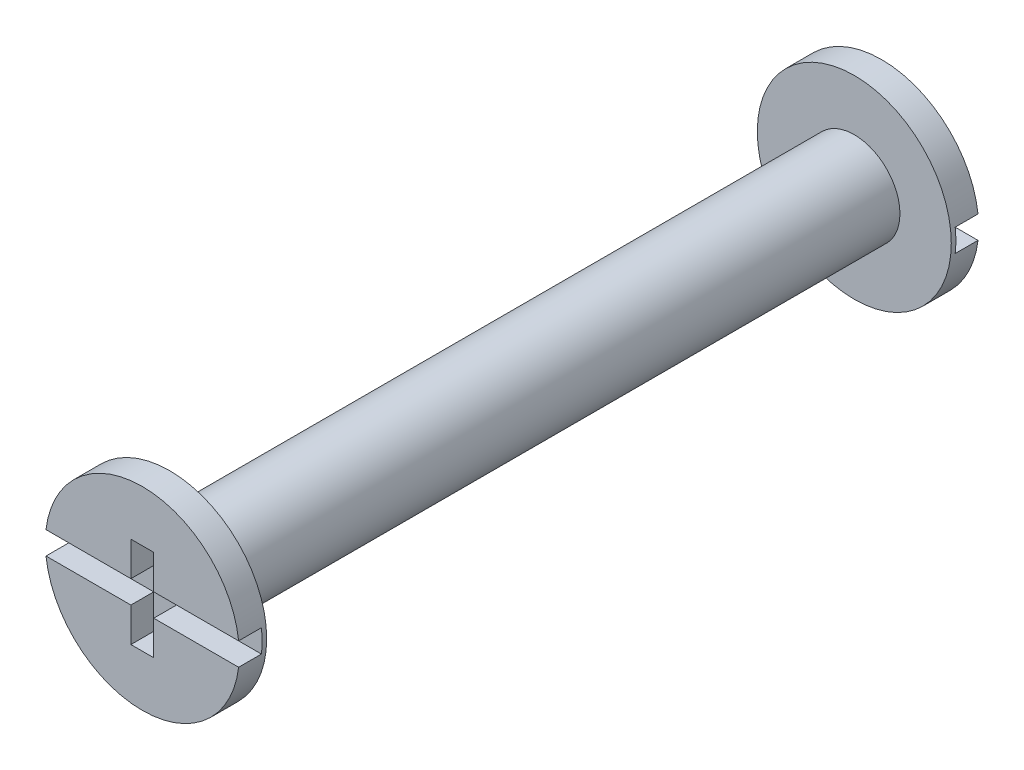
from build123d import *

# Parameters (mm, degrees)
SKETCH_1_R          = 4.25
EXTRUDE_1_DEPTH     = 1.2
SKETCH_2_R          = 2
EXTRUDE_2_DEPTH     = 30
SKETCH_3_R          = 4.25
EXTRUDE_3_DEPTH     = 1.2
CUT_EXTRUDE_1_DEPTH = 1
CUT_EXTRUDE_2_DEPTH = 1


with BuildPart() as part:
    # 草图1 → 凸台-拉伸1 (new body)
    with BuildSketch(Plane.XY):
        Circle(SKETCH_1_R)
    extrude(amount=EXTRUDE_1_DEPTH)

    # 草图2 → 凸台-拉伸2 (add)
    with BuildSketch(Plane.XY.offset(1.2)):
        Circle(SKETCH_2_R)
    extrude(amount=EXTRUDE_2_DEPTH)

    # 草图3 → 凸台-拉伸3 (add)
    with BuildSketch(Plane.XY.offset(31.2)):
        Circle(SKETCH_3_R)
    extrude(amount=EXTRUDE_3_DEPTH)

    # 草图4 → 切除-拉伸1 (cut)
    with BuildSketch(Plane.XY.offset(32.4)):
        with BuildLine():
            Line((-0.5, 2), (-0.5, 0.5))
            Line((-0.5, 0.5), (-4.723610907, 0.5))
            ThreePointArc((-4.723610907, 0.5), (-4.75, 0), (-4.723610907, -0.5))
            Line((-4.723610907, -0.5), (-0.5, -0.5))
            Line((-0.5, -0.5), (-0.5, -2))
            Line((-0.5, -2), (0.5, -2))
            Line((0.5, -2), (0.5, -0.5))
            Line((0.5, -0.5), (4.723610907, -0.5))
            ThreePointArc((4.723610907, -0.5), (4.75, 0), (4.723610907, 0.5))
            Line((4.723610907, 0.5), (0.5, 0.5))
            Line((0.5, 0.5), (0.5, 2))
            Line((0.5, 2), (-0.5, 2))
        make_face()
    extrude(amount=-CUT_EXTRUDE_1_DEPTH, mode=Mode.SUBTRACT)

    # 草图5 → 切除-拉伸2 (cut)
    with BuildSketch(Plane(origin=(0, 0, 0), x_dir=(-1, 0, 0), z_dir=(0, 0, -1))):
        with BuildLine():
            Line((-4.723610907, -0.5), (4.723610907, -0.5))
            ThreePointArc((4.723610907, -0.5), (4.75, 0), (4.723610907, 0.5))
            Line((4.723610907, 0.5), (-4.723610907, 0.5))
            ThreePointArc((-4.723610907, 0.5), (-4.75, 0), (-4.723610907, -0.5))
        make_face()
    extrude(amount=-CUT_EXTRUDE_2_DEPTH, mode=Mode.SUBTRACT)


solid = part.part
